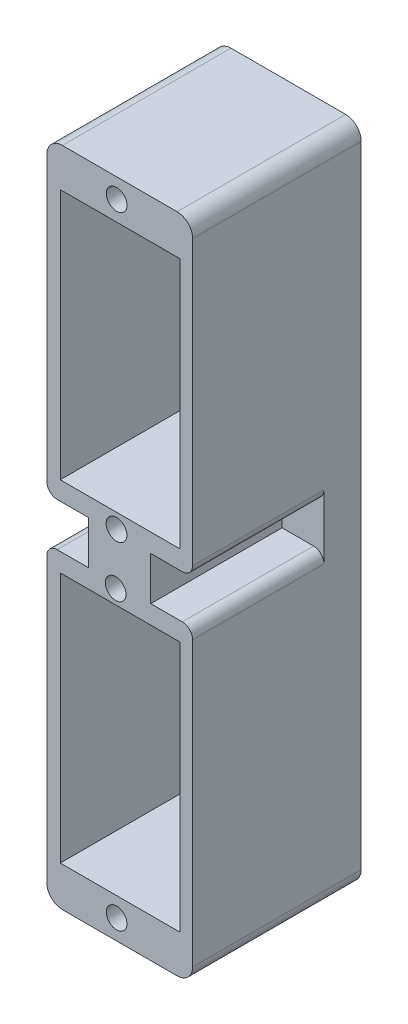
from build123d import *

# Parameters (mm, degrees)
SKETCH4_W           = 14.1
SKETCH4_H           = 64
BOSS_EXTRUDE1_DEPTH = 16.3
FILLET1_R           = 1.5
SKETCH5_W           = 11.6
SKETCH5_H           = 24.3
CUT_EXTRUDE1_DEPTH  = 16.3
SKETCH6_W           = 4.05
SKETCH6_H           = 4.2
CUT_EXTRUDE2_DEPTH  = 12.7
FILLET2_R           = 1
SKETCH7_R           = 1
CUT_EXTRUDE3_DEPTH  = 16.3


with BuildPart() as part:
    # Sketch4 → Boss-Extrude1 (new body)
    with BuildSketch(Plane.XY.offset(30)):
        with Locations((-182.786990356, 243.547210693)):
            Rectangle(SKETCH4_W, SKETCH4_H)
    extrude(amount=BOSS_EXTRUDE1_DEPTH)

    # Fillet1
    fillet1_edges = [part.edges().sort_by_distance(p)[0] for p in [
        (-189.836990356, 275.547210693, 38.15),
        (-175.736990356, 275.547210693, 38.15),
        (-175.736990356, 211.547210693, 38.15),
        (-189.836990356, 211.547210693, 38.15),
    ]]
    fillet(fillet1_edges, radius=FILLET1_R)

    # Sketch5 → Cut-Extrude1 (cut)
    with BuildSketch(Plane.XY.offset(46.3)):
        with Locations((-182.736990356, 259.597210693)):
            Rectangle(SKETCH5_W, SKETCH5_H)
        with Locations((-182.736990356, 227.497210693)):
            Rectangle(SKETCH5_W, SKETCH5_H)
    extrude(amount=-CUT_EXTRUDE1_DEPTH, mode=Mode.SUBTRACT)

    # Sketch6 → Cut-Extrude2 (cut)
    with BuildSketch(Plane.XY.offset(46.3)):
        with Locations((-187.811990356, 243.547210693)):
            Rectangle(SKETCH6_W, SKETCH6_H)
        with Locations((-177.761990356, 243.547210693)):
            Rectangle(SKETCH6_W, SKETCH6_H)
    extrude(amount=-CUT_EXTRUDE2_DEPTH, mode=Mode.SUBTRACT)

    # Fillet2
    fillet2_edges = [part.edges().sort_by_distance(p)[0] for p in [
        (-189.836990356, 241.447210693, 39.95),
        (-189.836990356, 245.647210693, 39.95),
        (-175.736990356, 245.647210693, 39.95),
        (-175.736990356, 241.447210693, 39.95),
    ]]
    fillet(fillet2_edges, radius=FILLET2_R)

    # Sketch7 → Cut-Extrude3 (cut)
    with BuildSketch(Plane.XY.offset(46.3)):
        with Locations((-183.086103711, 273.651926582)):
            Circle(SKETCH7_R)
        with Locations((-183.086103711, 213.475534384)):
            Circle(SKETCH7_R)
        with Locations((-183.098908316, 246.016003292)):
            Circle(SKETCH7_R)
        with Locations((-183.18196106, 241.016693115)):
            Circle(SKETCH7_R)
    extrude(amount=-CUT_EXTRUDE3_DEPTH, mode=Mode.SUBTRACT)


solid = part.part
